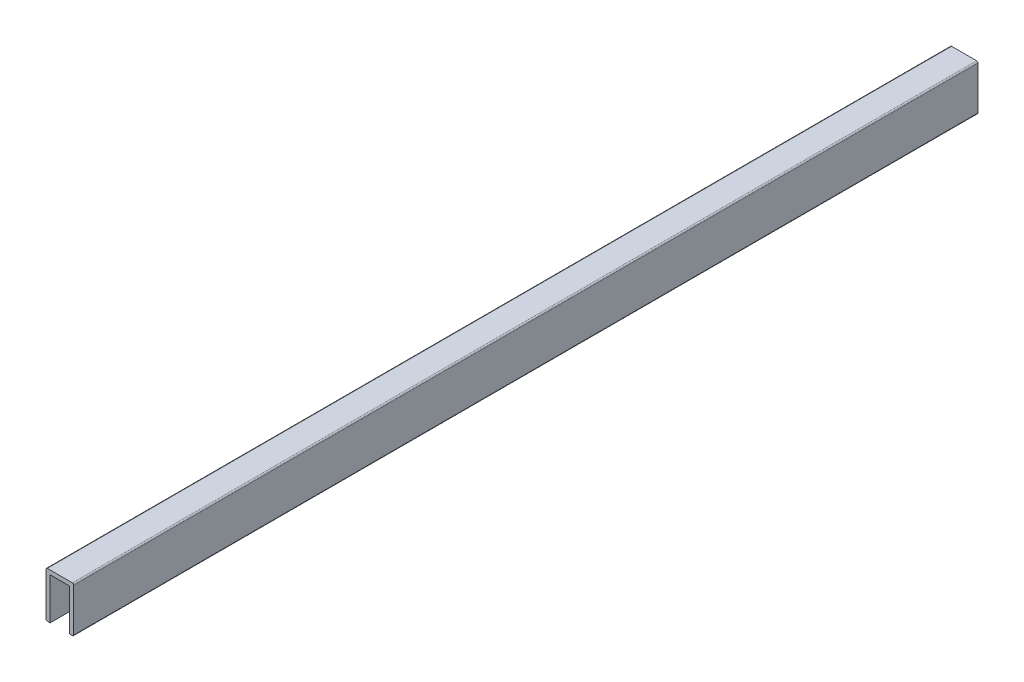
from build123d import *

# Parameters (mm, degrees)
BOSS_EXTRUDE1_DEPTH = 326
FILLET1_R           = 0.5


with BuildPart() as part:
    # Sketch1 → Boss-Extrude1 (new body)
    with BuildSketch(Plane.XY):
        Polygon((-5, -7.5), (-5, 9), (5, 9), (5, -7.5), (3.5, -7.5), (3.5, 7.5), (-3.5, 7.5), (-3.5, -7.5), align=None)
    extrude(amount=BOSS_EXTRUDE1_DEPTH)

    # Fillet1
    fillet1_edges = [part.edges().sort_by_distance(p)[0] for p in [
        (-5, -7.5, 163),
        (-5, 9, 163),
        (5, 9, 163),
        (5, -7.5, 163),
    ]]
    fillet(fillet1_edges, radius=FILLET1_R)


solid = part.part
